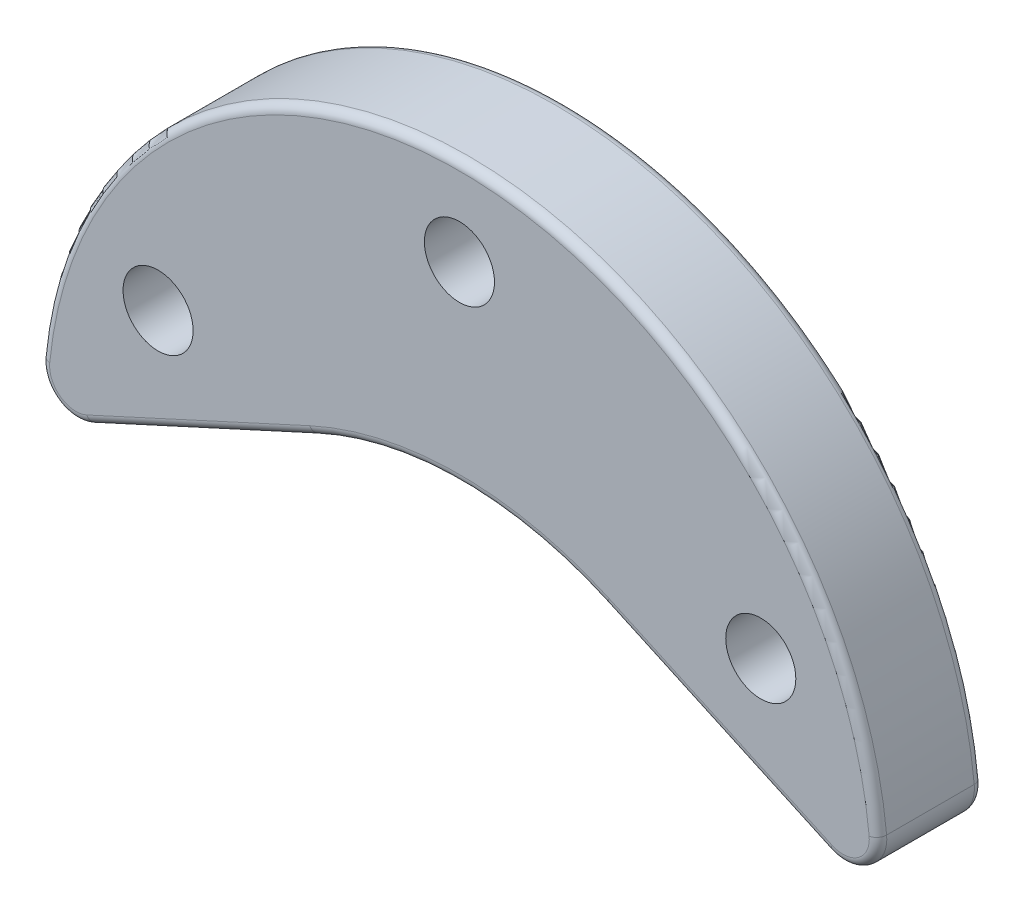
from build123d import *

# Parameters (mm, degrees)
BOSS_EXTRUDE2_DEPTH = 3
FILLET2_R           = 1
FILLET3_R           = 0.25
SKETCH4_R           = 1
CUT_EXTRUDE1_DEPTH  = 10


with BuildPart() as part:
    # Sketch3 → Boss-Extrude2 (new body)
    with BuildSketch(Plane.XY.offset(-6)):
        with BuildLine():
            Line((4.165977905, 3.090909091), (11.989810158, -0.494421262))
            ThreePointArc((11.989810158, -0.494421262), (0, 12), (-11.989810158, -0.494421262))
            Line((-11.989810158, -0.494421262), (-4.165977905, 3.090909091))
            ThreePointArc((-4.165977905, 3.090909091), (0, 4), (4.165977905, 3.090909091))
        make_face()
    extrude(amount=BOSS_EXTRUDE2_DEPTH)

    # Fillet2
    fillet2_edges = [part.edges().sort_by_distance(p)[0] for p in [
        (11.989810158, -0.494421262, -4.5),
        (-11.989810158, -0.494421262, -4.5),
    ]]
    fillet(fillet2_edges, radius=FILLET2_R)

    # Fillet3
    fillet3_edges = [part.edges().sort_by_distance(p)[0] for p in [
        (0, 4, -3),
        (7.347934502, 1.632753394, -3),
        (-7.347934502, 1.632753394, -6),
        (-7.347934502, 1.632753394, -3),
        (0, 12, -6),
        (11.527432024, 0.26974446, -6),
        (-11.527432024, 0.26974446, -6),
        (0, 12, -3),
        (11.527432024, 0.26974446, -3),
        (-11.527432024, 0.26974446, -3),
        (7.347934502, 1.632753394, -6),
        (0, 4, -6),
    ]]
    fillet(fillet3_edges, radius=FILLET3_R)

    # Sketch4 → Cut-Extrude1 (cut)
    with BuildSketch(Plane(origin=(0, 0, -6), x_dir=(-1, 0, 0), z_dir=(0, 0, -1))):
        with Locations((0, 9.5)):
            Circle(SKETCH4_R)
        with Locations((8.6, 4)):
            Circle(SKETCH4_R)
        with Locations((-8.6, 4)):
            Circle(SKETCH4_R)
    extrude(amount=-CUT_EXTRUDE1_DEPTH, mode=Mode.SUBTRACT)


solid = part.part
